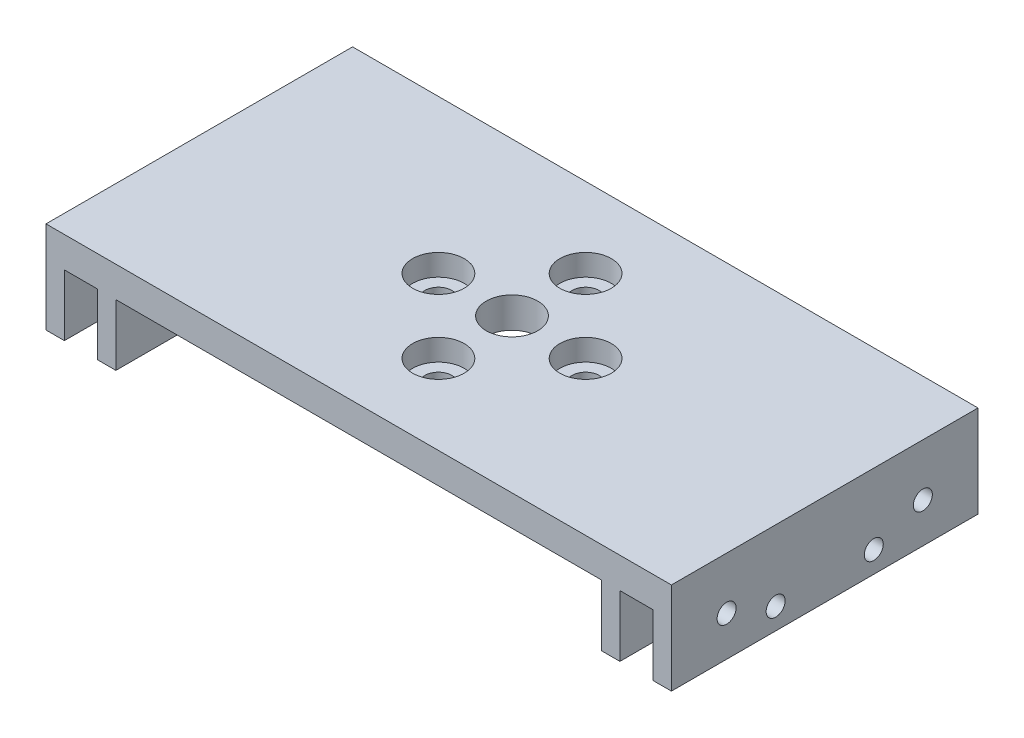
from build123d import *

# Parameters (mm, degrees)
SKETCH4_W           = 102
SKETCH4_H           = 50
SKETCH4_R           = 4.2
SKETCH4_R_2         = 2.2
BOSS_EXTRUDE3_DEPTH = 5
SKETCH16_W          = 3
SKETCH16_H          = 50
BOSS_EXTRUDE4_DEPTH = 10
CUT_EXTRUDE10_REACH = 108.085
SKETCH17_R          = 1.55
CUT_EXTRUDE11_START = -11.4
SKETCH18_R          = 1.55
CUT_EXTRUDE11_DEPTH = 11.4
SKETCH19_R          = 4.2
CUT_EXTRUDE12_DEPTH = 3.5


with BuildPart() as part:
    # Sketch4 → Boss-Extrude3 (new body)
    with BuildSketch(Plane(origin=(0, 0, 0), x_dir=(1, 0, 0), z_dir=(0, 1, 0))):
        Rectangle(SKETCH4_W, SKETCH4_H)
        with Locations(Location((0, 0, 0), (0, 0, 270))):
            Circle(SKETCH4_R, mode=Mode.SUBTRACT)
        with Locations(Location((0, -12, 0), (0, 0, 270))):
            Circle(SKETCH4_R_2, mode=Mode.SUBTRACT)
        with Locations(Location((-12, 0, 0), (0, 0, 270))):
            Circle(SKETCH4_R_2, mode=Mode.SUBTRACT)
        with Locations(Location((0, 12, 0), (0, 0, 270))):
            Circle(SKETCH4_R_2, mode=Mode.SUBTRACT)
        with Locations(Location((12, 0, 0), (0, 0, 270))):
            Circle(SKETCH4_R_2, mode=Mode.SUBTRACT)
    extrude(amount=-BOSS_EXTRUDE3_DEPTH)

    # Sketch16 → Boss-Extrude4 (add)
    with BuildSketch(Plane.XZ.offset(5)):
        with Locations((-41.1, 0)):
            Rectangle(SKETCH16_W, SKETCH16_H)
        with Locations((-49.5, 0)):
            Rectangle(SKETCH16_W, SKETCH16_H)
        with Locations((41.1, 0)):
            Rectangle(SKETCH16_W, SKETCH16_H)
        with Locations((49.5, 0)):
            Rectangle(SKETCH16_W, SKETCH16_H)
    extrude(amount=BOSS_EXTRUDE4_DEPTH)

    # Cut-Extrude10: up to this face of the body (flat: up to its plane)
    cut_extrude10_end = Plane(part.part.faces().sort_by_distance((-39.6, -10, 0))[0])
    # Sketch17 → Cut-Extrude10 (cut, up to the picked face)
    with BuildSketch(Plane.ZY.offset(51), mode=Mode.PRIVATE) as cut_extrude10_sk1:
        with Locations((-16, -8.5)):
            Circle(SKETCH17_R)
    cut_extrude10_tool1 = split(extrude(cut_extrude10_sk1.sketch, amount=-CUT_EXTRUDE10_REACH, mode=Mode.PRIVATE), bisect_by=cut_extrude10_end, keep=Keep.BOTH, mode=Mode.PRIVATE)
    # Sketch17 → Cut-Extrude10 (cut, up to the picked face)
    with BuildSketch(Plane.ZY.offset(51), mode=Mode.PRIVATE) as cut_extrude10_sk2:
        with Locations((-8, -11.5)):
            Circle(SKETCH17_R)
    cut_extrude10_tool2 = split(extrude(cut_extrude10_sk2.sketch, amount=-CUT_EXTRUDE10_REACH, mode=Mode.PRIVATE), bisect_by=cut_extrude10_end, keep=Keep.BOTH, mode=Mode.PRIVATE)
    # Sketch17 → Cut-Extrude10 (cut, up to the picked face)
    with BuildSketch(Plane.ZY.offset(51), mode=Mode.PRIVATE) as cut_extrude10_sk3:
        with Locations((8, -11.5)):
            Circle(SKETCH17_R)
    cut_extrude10_tool3 = split(extrude(cut_extrude10_sk3.sketch, amount=-CUT_EXTRUDE10_REACH, mode=Mode.PRIVATE), bisect_by=cut_extrude10_end, keep=Keep.BOTH, mode=Mode.PRIVATE)
    # Sketch17 → Cut-Extrude10 (cut, up to the picked face)
    with BuildSketch(Plane.ZY.offset(51), mode=Mode.PRIVATE) as cut_extrude10_sk4:
        with Locations((16, -8.5)):
            Circle(SKETCH17_R)
    cut_extrude10_tool4 = split(extrude(cut_extrude10_sk4.sketch, amount=-CUT_EXTRUDE10_REACH, mode=Mode.PRIVATE), bisect_by=cut_extrude10_end, keep=Keep.BOTH, mode=Mode.PRIVATE)
    add(cut_extrude10_tool1.solids().sort_by(Axis((-51, -8.5, -16), (1, 0, 0)))[0], mode=Mode.SUBTRACT)
    add(cut_extrude10_tool2.solids().sort_by(Axis((-51, -11.5, -8), (1, 0, 0)))[0], mode=Mode.SUBTRACT)
    add(cut_extrude10_tool3.solids().sort_by(Axis((-51, -11.5, 8), (1, 0, 0)))[0], mode=Mode.SUBTRACT)
    add(cut_extrude10_tool4.solids().sort_by(Axis((-51, -8.5, 16), (1, 0, 0)))[0], mode=Mode.SUBTRACT)

    # Sketch18 → Cut-Extrude11 (cut)
    with BuildSketch(Plane(origin=(51, 0, 0), x_dir=(0, 0, -1), z_dir=(1, 0, 0)).offset(CUT_EXTRUDE11_START)):
        with Locations(Location((-8, -11.5, 0), (0, 0, 180))):
            Circle(SKETCH18_R)
        with Locations(Location((8, -11.5, 0), (0, 0, 180))):
            Circle(SKETCH18_R)
        with Locations(Location((16, -8.5, 0), (0, 0, 180))):
            Circle(SKETCH18_R)
        with Locations(Location((-16, -8.5, 0), (0, 0, 180))):
            Circle(SKETCH18_R)
    extrude(amount=CUT_EXTRUDE11_DEPTH, mode=Mode.SUBTRACT)

    # Sketch19 → Cut-Extrude12 (cut)
    with BuildSketch(Plane(origin=(0, 0, 0), x_dir=(1, 0, 0), z_dir=(0, 1, 0))):
        with Locations(Location((0, 12, 0), (0, 0, 270))):
            Circle(SKETCH19_R)
        with Locations(Location((12, 0, 0), (0, 0, 270))):
            Circle(SKETCH19_R)
        with Locations(Location((0, -12, 0), (0, 0, 270))):
            Circle(SKETCH19_R)
        with Locations(Location((-12, 0, 0), (0, 0, 270))):
            Circle(SKETCH19_R)
    extrude(amount=-CUT_EXTRUDE12_DEPTH, mode=Mode.SUBTRACT)


solid = part.part
